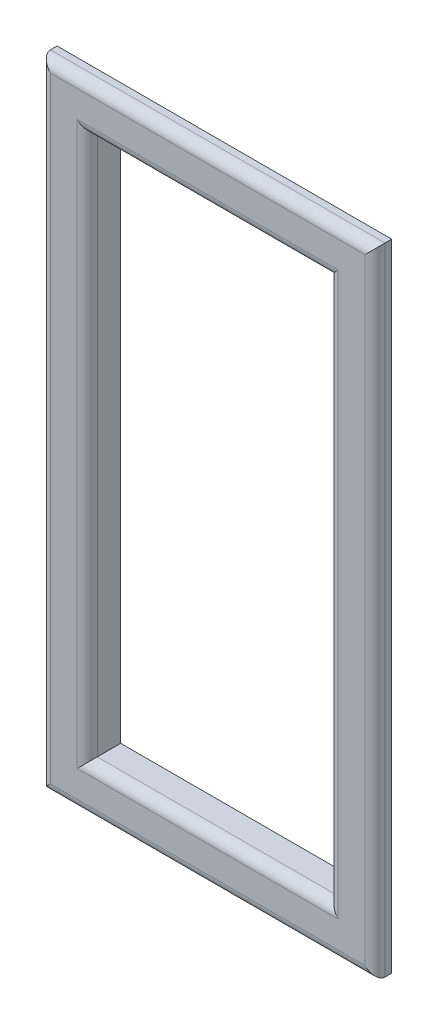
from build123d import *

# Parameters (mm, degrees)
CROQUIS1_W              = 40
CROQUIS1_H              = 85
CROQUIS1_W_2            = 36
CROQUIS1_H_2            = 81
SALIENTE_EXTRUIR2_DEPTH = 2.5
CROQUIS2_W              = 50
CROQUIS2_H              = 95
CROQUIS2_W_2            = 40
CROQUIS2_H_2            = 85
SALIENTE_EXTRUIR3_DEPTH = 2.5
REDONDEO1_R             = 1.5


with BuildPart() as part:
    # Croquis1 → Saliente-Extruir2 (new, symmetric)
    with BuildSketch(Plane.XY):
        Rectangle(CROQUIS1_W, CROQUIS1_H)
        Rectangle(CROQUIS1_W_2, CROQUIS1_H_2, mode=Mode.SUBTRACT)
    extrude(amount=SALIENTE_EXTRUIR2_DEPTH, both=True)

    # Croquis2 → Saliente-Extruir3 (add)
    with BuildSketch(Plane.XY):
        Rectangle(CROQUIS2_W, CROQUIS2_H)
        Rectangle(CROQUIS2_W_2, CROQUIS2_H_2, mode=Mode.SUBTRACT)
    extrude(amount=SALIENTE_EXTRUIR3_DEPTH)

    # Redondeo1
    redondeo1_edges = [part.edges().sort_by_distance(p)[0] for p in [
        (-18, 0, 2.5),
        (0, -40.5, 2.5),
        (18, 0, 2.5),
        (0, 40.5, 2.5),
        (-25, 0, 2.5),
        (0, -47.5, 2.5),
        (25, 0, 2.5),
        (0, 47.5, 2.5),
    ]]
    fillet(redondeo1_edges, radius=REDONDEO1_R)


solid = part.part
